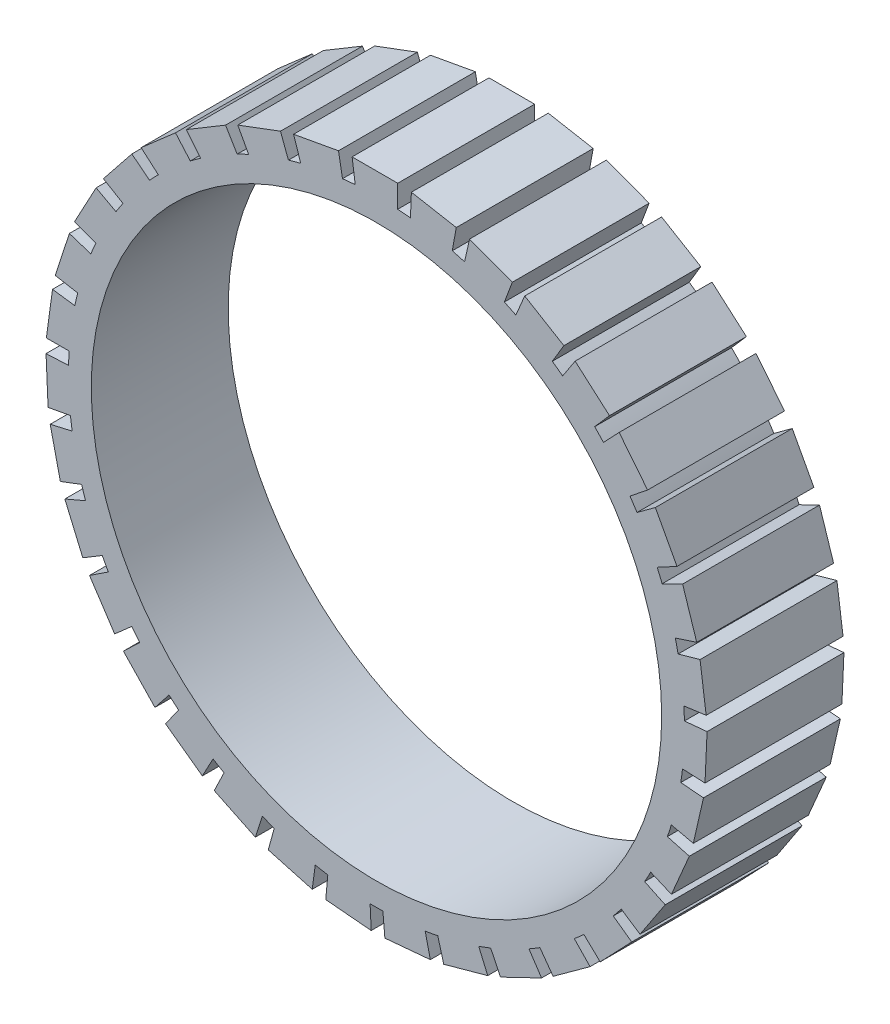
from build123d import *

# Parameters (mm, degrees)
SKETCH2_R           = 25
BOSS_EXTRUDE1_DEPTH = 12


with BuildPart() as part:
    # Sketch2 → Boss-Extrude1 (new body)
    with BuildSketch(Plane.XY):
        with BuildLine():
            Line((-2.137931034, 28.911787374), (1.862068966, 28.911787374))
            Line((1.862068966, 28.911787374), (1.862068966, 26.935714194))
            ThreePointArc((1.862068966, 26.935714194), (2.42026134, 26.891305938), (2.977412735, 26.835331438))
            Line((2.977412735, 26.835331438), (3.058825373, 28.828905384))
            Line((3.058825373, 28.828905384), (6.994543728, 28.114677805))
            Line((6.994543728, 28.114677805), (6.641702237, 26.170360934))
            ThreePointArc((6.641702237, 26.170360934), (7.18299483, 26.026997239), (7.72119794, 25.87243905))
            Line((7.72119794, 25.87243905), (8.157268617, 27.819438654))
            Line((8.157268617, 27.819438654), (11.9022081, 26.413939357))
            Line((11.9022081, 26.413939357), (11.207865734, 24.563870739))
            ThreePointArc((11.207865734, 24.563870739), (11.714860956, 24.326159433), (12.21681749, 24.077985182))
            Line((12.21681749, 24.077985182), (12.993530536, 25.915832275))
            Line((12.993530536, 25.915832275), (16.42732571, 23.864235166))
            Line((16.42732571, 23.864235166), (15.413799204, 22.167877528))
            ThreePointArc((15.413799204, 22.167877528), (15.870201812, 21.843458848), (16.319778474, 21.509645059))
            Line((16.319778474, 21.509645059), (17.412169691, 23.179269724))
            Line((17.412169691, 23.179269724), (20.424455555, 20.54751482))
            Line((20.424455555, 20.54751482), (19.124320485, 19.059390494))
            ThreePointArc((19.124320485, 19.059390494), (19.515461323, 18.658691523), (19.89820835, 18.249967246))
            Line((19.89820835, 18.249967246), (21.271167387, 19.697706372))
            Line((21.271167387, 19.697706372), (23.765126594, 16.570380442))
            Line((23.765126594, 16.570380442), (22.22017037, 15.338318966))
            ThreePointArc((22.22017037, 15.338318966), (22.53347785, 14.874218499), (22.837093437, 14.403720469))
            Line((22.837093437, 14.403720469), (24.44649226, 15.583042529))
            Line((24.44649226, 15.583042529), (26.34196691, 12.060660402))
            Line((26.34196691, 12.060660402), (24.601845697, 11.124261247))
            ThreePointArc((24.601845697, 11.124261247), (24.827249859, 10.611675855), (25.041975551, 10.094526265))
            Line((25.041975551, 10.094526265), (26.836086758, 10.967526878))
            Line((26.836086758, 10.967526878), (28.072154735, 7.163300813))
            Line((28.072154735, 7.163300813), (26.192797461, 6.552660618))
            ThreePointArc((26.192797461, 6.552660618), (26.323053629, 6.008065217), (26.441987966, 5.460885681))
            Line((26.441987966, 5.460885681), (28.363147346, 5.999505889))
            Line((28.363147346, 5.999505889), (28.900080409, 2.035706842))
            Line((28.900080409, 2.035706842), (26.941891163, 1.770452086))
            ThreePointArc((26.941891163, 1.770452086), (26.972812797, 1.211350419), (26.992133131, 0.651727738))
            Line((26.992133131, 0.651727738), (28.978593042, 0.838655845))
            Line((28.978593042, 0.838655845), (28.79913372, -3.157316422))
            Line((28.79913372, -3.157316422), (26.825050314, -3.068660234))
            ThreePointArc((26.825050314, -3.068660234), (26.755643568, -3.624298177), (26.674728928, -4.17837727))
            Line((26.674728928, -4.17837727), (28.662642913, -4.349149289))
            Line((28.662642913, -4.349149289), (27.772559177, -8.248860938))
            Line((27.772559177, -8.248860938), (25.846030277, -7.809143288))
            ThreePointArc((25.846030277, -7.809143288), (25.67852594, -8.343458848), (25.499976989, -8.874185796))
            Line((25.499976989, -8.874185796), (27.425451857, -9.397169186))
            Line((27.425451857, -9.397169186), (25.853351731, -13.075280276))
            Line((25.853351731, -13.075280276), (24.036297561, -12.298634052))
            ThreePointArc((24.036297561, -12.298634052), (23.77607936, -12.794453887), (23.505634809, -13.284770688))
            Line((23.505634809, -13.284770688), (25.306784213, -14.143156333))
            Line((25.306784213, -14.143156333), (23.103196288, -17.481449348))
            Line((23.103196288, -17.481449348), (21.454018464, -16.392836598))
            ThreePointArc((21.454018464, -16.392836598), (21.109450027, -16.83422465), (20.755802185, -17.268372119))
            Line((20.755802185, -17.268372119), (22.374735702, -18.434570799))
            Line((22.374735702, -18.434570799), (19.610485106, -21.325750254))
            Line((19.610485106, -21.325750254), (18.182189561, -19.960159888))
            ThreePointArc((18.182189561, -19.960159888), (17.7643456, -20.332929582), (17.338861001, -20.696953862))
            Line((17.338861001, -20.696953862), (18.723544776, -22.133482991))
            Line((18.723544776, -22.133482991), (15.487476798, -24.484624))
            Line((15.487476798, -24.484624), (14.325970126, -22.885947216))
            ThreePointArc((14.325970126, -22.885947216), (13.84828049, -23.178117427), (13.364634558, -23.460318479))
            Line((13.364634558, -23.460318479), (14.470563714, -25.121006829))
            Line((14.470563714, -25.121006829), (10.866688243, -26.856541785))
            Line((10.866688243, -26.856541785), (10.009302223, -25.076161369))
            ThreePointArc((10.009302223, -25.076161369), (9.48712025, -25.278341507), (8.960857764, -25.469649156))
            Line((8.960857764, -25.469649156), (9.752486829, -27.301120837))
            Line((9.752486829, -27.301120837), (5.896635386, -28.365268219))
            Line((5.896635386, -28.365268219), (5.370927111, -26.460407064))
            ThreePointArc((5.370927111, -26.460407064), (4.82103616, -26.566098892), (4.269071629, -26.660364353))
            Line((4.269071629, -26.660364353), (4.720956992, -28.603754358))
            Line((4.720956992, -28.603754358), (0.737059816, -28.962311594))
            Line((0.737059816, -28.962311594), (0.559925982, -26.994193503))
            ThreePointArc((0.559925982, -26.994193503), (0, -27), (-0.559925982, -26.994193503))
            Line((-0.559925982, -26.994193503), (-0.462308287, -28.987039679))
            Line((-0.462308287, -28.987039679), (-4.446205463, -28.628482443))
            Line((-4.446205463, -28.628482443), (-4.269071629, -26.660364353))
            ThreePointArc((-4.269071629, -26.660364353), (-4.82103616, -26.566098892), (-5.370927111, -26.460407064))
            Line((-5.370927111, -26.460407064), (-5.630714597, -28.438657694))
            Line((-5.630714597, -28.438657694), (-9.48656604, -27.374510312))
            Line((-9.48656604, -27.374510312), (-8.960857764, -25.469649156))
            ThreePointArc((-8.960857764, -25.469649156), (-9.48712025, -25.278341507), (-10.009302223, -25.076161369))
            Line((-10.009302223, -25.076161369), (-10.618145107, -26.976233851))
            Line((-10.618145107, -26.976233851), (-14.222020578, -25.240698895))
            Line((-14.222020578, -25.240698895), (-13.364634558, -23.460318479))
            ThreePointArc((-13.364634558, -23.460318479), (-13.84828049, -23.178117427), (-14.325970126, -22.885947216))
            Line((-14.325970126, -22.885947216), (-15.264299696, -24.646771656))
            Line((-15.264299696, -24.646771656), (-18.500367674, -22.295630647))
            Line((-18.500367674, -22.295630647), (-17.338861001, -20.696953862))
            ThreePointArc((-17.338861001, -20.696953862), (-17.7643456, -20.332929582), (-18.182189561, -19.960159888))
            Line((-18.182189561, -19.960159888), (-19.419847134, -21.525141941))
            Line((-19.419847134, -21.525141941), (-22.18409773, -18.633962486))
            Line((-22.18409773, -18.633962486), (-20.755802185, -17.268372119))
            ThreePointArc((-20.755802185, -17.268372119), (-21.109450027, -16.83422465), (-21.454018464, -16.392836598))
            Line((-21.454018464, -16.392836598), (-22.951224707, -17.711676453))
            Line((-22.951224707, -17.711676453), (-25.154812632, -14.373383438))
            Line((-25.154812632, -14.373383438), (-23.505634809, -13.284770688))
            ThreePointArc((-23.505634809, -13.284770688), (-23.77607936, -12.794453887), (-24.036297561, -12.298634052))
            Line((-24.036297561, -12.298634052), (-25.744931032, -13.32894311))
            Line((-25.744931032, -13.32894311), (-27.317031159, -9.65083202))
            Line((-27.317031159, -9.65083202), (-25.499976989, -8.874185796))
            ThreePointArc((-25.499976989, -8.874185796), (-25.67852594, -8.343458848), (-25.846030277, -7.809143288))
            Line((-25.846030277, -7.809143288), (-27.711174092, -8.517806569))
            Line((-27.711174092, -8.517806569), (-28.601257828, -4.61809492))
            Line((-28.601257828, -4.61809492), (-26.674728928, -4.17837727))
            ThreePointArc((-26.674728928, -4.17837727), (-26.755643568, -3.624298177), (-26.825050314, -3.068660234))
            Line((-26.825050314, -3.068660234), (-28.786757215, -3.432900716))
            Line((-28.786757215, -3.432900716), (-28.966216537, 0.56307155))
            Line((-28.966216537, 0.56307155), (-26.992133131, 0.651727738))
            ThreePointArc((-26.992133131, 0.651727738), (-26.972812797, 1.211350419), (-26.941891163, 1.770452086))
            Line((-26.941891163, 1.770452086), (-28.937110276, 1.762341391))
            Line((-28.937110276, 1.762341391), (-28.400177213, 5.726140438))
            Line((-28.400177213, 5.726140438), (-26.441987966, 5.460885681))
            ThreePointArc((-26.441987966, 5.460885681), (-26.323053629, 6.008065217), (-26.192797461, 6.552660618))
            Line((-26.192797461, 6.552660618), (-28.157400803, 6.900940395))
            Line((-28.157400803, 6.900940395), (-26.921332825, 10.70516646))
            Line((-26.921332825, 10.70516646), (-25.041975551, 10.094526265))
            ThreePointArc((-25.041975551, 10.094526265), (-24.827249859, 10.611675855), (-24.601845697, 11.124261247))
            Line((-24.601845697, 11.124261247), (-26.4726893, 11.817737496))
            Line((-26.4726893, 11.817737496), (-24.57721465, 15.340119624))
            Line((-24.57721465, 15.340119624), (-22.837093437, 14.403720469))
            ThreePointArc((-22.837093437, 14.403720469), (-22.53347785, 14.874218499), (-22.22017037, 15.338318966))
            Line((-22.22017037, 15.338318966), (-23.937123781, 16.354702791))
            Line((-23.937123781, 16.354702791), (-21.443164573, 19.482028721))
            Line((-21.443164573, 19.482028721), (-19.89820835, 18.249967246))
            ThreePointArc((-19.89820835, 18.249967246), (-19.515461323, 18.658691523), (-19.124320485, 19.059390494))
            Line((-19.124320485, 19.059390494), (-20.632199408, 20.366014482))
            Line((-20.632199408, 20.366014482), (-17.619913544, 22.997769386))
            Line((-17.619913544, 22.997769386), (-16.319778474, 21.509645059))
            ThreePointArc((-16.319778474, 21.509645059), (-15.870201812, 21.843458848), (-15.413799204, 22.167877528))
            Line((-15.413799204, 22.167877528), (-16.66413917, 23.72274571))
            Line((-16.66413917, 23.72274571), (-13.230343996, 25.774342819))
            Line((-13.230343996, 25.774342819), (-12.21681749, 24.077985182))
            ThreePointArc((-12.21681749, 24.077985182), (-11.714860956, 24.326159433), (-11.207865734, 24.563870739))
            Line((-11.207865734, 24.563870739), (-12.160479788, 26.317008371))
            Line((-12.160479788, 26.317008371), (-8.415540306, 27.722507668))
            Line((-8.415540306, 27.722507668), (-7.72119794, 25.87243905))
            ThreePointArc((-7.72119794, 25.87243905), (-7.18299483, 26.026997239), (-6.641702237, 26.170360934))
            Line((-6.641702237, 26.170360934), (-7.26597258, 28.06542073))
            Line((-7.26597258, 28.06542073), (-3.330254225, 28.779648309))
            Line((-3.330254225, 28.779648309), (-2.977412735, 26.835331438))
            ThreePointArc((-2.977412735, 26.835331438), (-2.42026134, 26.891305938), (-1.862068966, 26.935714194))
            Line((-1.862068966, 26.935714194), (-2.137931034, 28.911787374))
        make_face()
        Circle(SKETCH2_R, mode=Mode.SUBTRACT)
    extrude(amount=BOSS_EXTRUDE1_DEPTH)


solid = part.part
